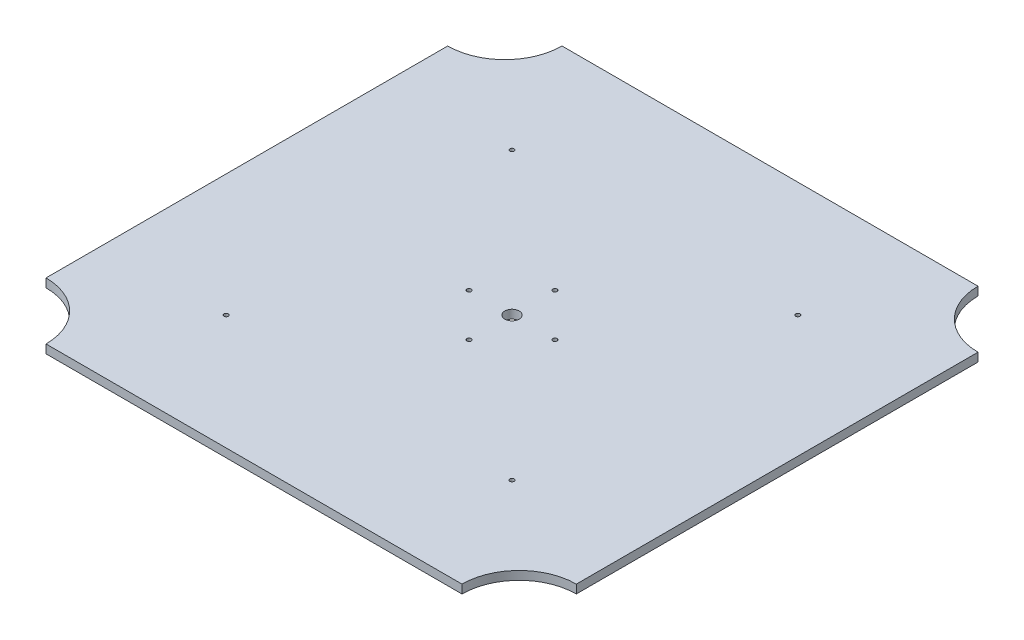
from build123d import *

# Parameters (mm, degrees)
SKETCH_1_R        = 5
SKETCH_1_R_2      = 1.5
EXTRUDE_636_DEPTH = 6


with BuildPart() as part:
    # 草图1 → Extrude 636 (new body)
    with BuildSketch(Plane(origin=(0, 0, 0), x_dir=(1, 0, 0), z_dir=(0, 1, 0))):
        with BuildLine():
            Line((-145.5, 180.5), (145.5, 180.5))
            ThreePointArc((145.5, 180.5), (157.215728753, 152.215728753), (185.5, 140.5))
            Line((185.5, 140.5), (185.5, -140.5))
            ThreePointArc((185.5, -140.5), (157.215728753, -152.215728753), (145.5, -180.5))
            Line((145.5, -180.5), (-145.5, -180.5))
            ThreePointArc((-145.5, -180.5), (-157.215728753, -152.215728753), (-185.5, -140.5))
            Line((-185.5, -140.5), (-185.5, 140.5))
            ThreePointArc((-185.5, 140.5), (-157.215728753, 152.215728753), (-145.5, 180.5))
        make_face()
        with Locations(Location((0, 0, 0), (0, 0, 270))):
            Circle(SKETCH_1_R, mode=Mode.SUBTRACT)
        with Locations(Location((0, 30, 0), (0, 0, 270))):
            Circle(SKETCH_1_R_2, mode=Mode.SUBTRACT)
        with Locations(Location((30, 0, 0), (0, 0, 270))):
            Circle(SKETCH_1_R_2, mode=Mode.SUBTRACT)
        with Locations(Location((0, -30, 0), (0, 0, 270))):
            Circle(SKETCH_1_R_2, mode=Mode.SUBTRACT)
        with Locations(Location((-30, 0, 0), (0, 0, 270))):
            Circle(SKETCH_1_R_2, mode=Mode.SUBTRACT)
        with Locations(Location((-100, 100, 0), (0, 0, 270))):
            Circle(SKETCH_1_R_2, mode=Mode.SUBTRACT)
        with Locations(Location((100, 100, 0), (0, 0, 270))):
            Circle(SKETCH_1_R_2, mode=Mode.SUBTRACT)
        with Locations(Location((100, -100, 0), (0, 0, 270))):
            Circle(SKETCH_1_R_2, mode=Mode.SUBTRACT)
        with Locations(Location((-100, -100, 0), (0, 0, 270))):
            Circle(SKETCH_1_R_2, mode=Mode.SUBTRACT)
    extrude(amount=EXTRUDE_636_DEPTH)


solid = part.part
